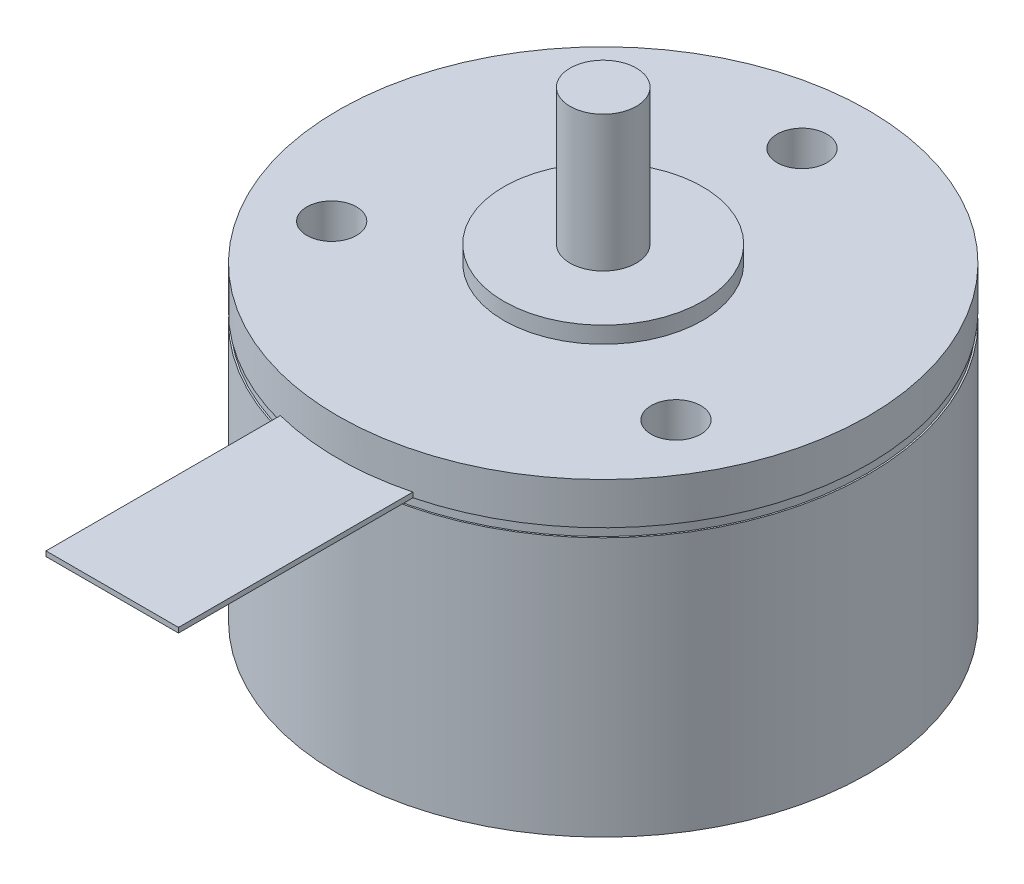
from build123d import *

# Parameters (mm, degrees)
CROQUIS1_R              = 16
CROQUIS1_R_2            = 1.5
CROQUIS1_R_3            = 6
SALIENTE_EXTRUIR1_DEPTH = 2.2
CROQUIS1_3_R            = 6
CROQUIS1_3_R_2          = 2
SALIENTE_EXTRUIR2_DEPTH = 3.2
CROQUIS1_4_R            = 2
SALIENTE_EXTRUIR3_DEPTH = 11.4
CROQUIS5_W              = 8
CROQUIS5_H              = 20.560227787
SALIENTE_EXTRUIR4_DEPTH = 0.3


with BuildPart() as part:
    # Croquis1 → Saliente-Extruir1 (new body)
    with BuildSketch(Plane(origin=(0, 0, 0), x_dir=(1, 0, 0), z_dir=(0, 1, 0))):
        Circle(CROQUIS1_R)
        with Locations((0, 12)):
            Circle(CROQUIS1_R_2, mode=Mode.SUBTRACT)
        with Locations((-10.392304845, -6)):
            Circle(CROQUIS1_R_2, mode=Mode.SUBTRACT)
        with Locations((10.392304845, -6)):
            Circle(CROQUIS1_R_2, mode=Mode.SUBTRACT)
        Circle(CROQUIS1_R_3, mode=Mode.SUBTRACT)
    extrude(amount=SALIENTE_EXTRUIR1_DEPTH)



with BuildPart() as body_2:
    # Croquis1<3> → Saliente-Extruir2 (new body)
    with BuildSketch(Plane(origin=(0, 0, 0), x_dir=(1, 0, 0), z_dir=(0, 1, 0))):
        Circle(CROQUIS1_3_R)
        Circle(CROQUIS1_3_R_2, mode=Mode.SUBTRACT)
    extrude(amount=SALIENTE_EXTRUIR2_DEPTH)


with BuildPart() as part_1:
    add(part.part)

    add(body_2.part)  # Saliente-Extruir3 merges body 2
    # Croquis1<4> → Saliente-Extruir3 (add)
    with BuildSketch(Plane(origin=(0, 0, 0), x_dir=(1, 0, 0), z_dir=(0, 1, 0))):
        Circle(CROQUIS1_4_R)
    extrude(amount=SALIENTE_EXTRUIR3_DEPTH)

    # Croquis4 → Revolución1 (revolve)
    with BuildSketch(Plane(origin=(0, 0, 0), x_dir=(0, 0, -1), z_dir=(1, 0, 0))):
        Polygon((15.909149683, -0.847381969), (15.909149683, -0.322612836), (16, -0.322612836), (16, 0), (0, 0), (0, -16.5), (1, -16.5), (1.1, -16.5), (16, -16.5), (16, -0.847381969), align=None)
    revolve(axis=Axis((0, 0, 0), (0, -1, 0)))

    # Croquis5 → Saliente-Extruir4 (add)
    with BuildSketch(Plane(origin=(0, -0.322612836, 0), x_dir=(-1, 0, 0), z_dir=(0, -1, 0))):
        with Locations((0, -19.361082391)):
            Rectangle(CROQUIS5_W, CROQUIS5_H)
    extrude(amount=-SALIENTE_EXTRUIR4_DEPTH)


solid = part_1.part
